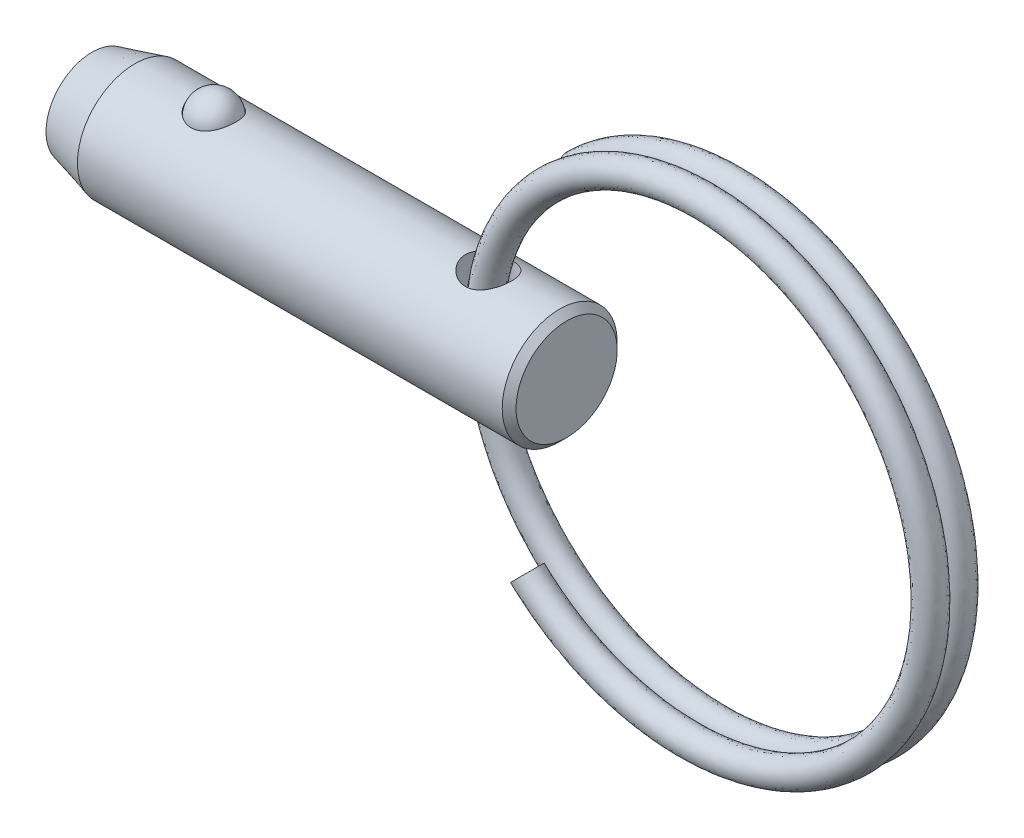
from build123d import *

# Parameters (mm, degrees)
SKETCH4_W          = 1.27
SKETCH4_H          = 6.35
SWEEP1_PITCH       = 1.5494
SWEEP1_HEIGHT      = 1.355725
SWEEP1_RADIUS      = 13.462
SKETCH6_R          = 0.762
SWEEP2_PITCH       = 1.5494
SWEEP2_HEIGHT      = 1.355725
SWEEP2_RADIUS      = 13.462
SWEEP2_START_ANGLE = -180
SKETCH6_2_R        = 0.762


with BuildPart() as part:
    # Sketch1 → Revolve1 (revolve)
    with BuildSketch(Plane.XY, mode=Mode.PRIVATE) as revolve1_sk:
        Polygon((5.588, 2.794), (5.207, 3.175), (-18.254947737, 3.175), (-20.6248, 2.54), (-20.6248, 0), (5.588, 0), align=None)
    revolve(revolve1_sk.sketch.rotate(Axis((5.588, 0, 0), (1, 0, 0)), 90), axis=Axis((5.588, 0, 0), (1, 0, 0)))

    # Sketch2 → Cut-Revolve1 (revolve, cut)
    with BuildSketch(Plane.XY):
        with BuildLine():
            Line((-12.632982051, 2.8575), (-15.147582051, 2.8575))
            ThreePointArc((-15.147582051, 2.8575), (-13.890282051, 4.1148), (-12.632982051, 2.8575))
        make_face()
    revolve(axis=Axis((-12.632982051, 2.8575, 0), (1, 0, 0)), mode=Mode.SUBTRACT)

    # Sketch4 → Cut-Revolve2 (revolve, cut)
    with BuildSketch(Plane.XY, mode=Mode.PRIVATE) as cut_revolve2_sk:
        with Locations((1.905, 0)):
            Rectangle(SKETCH4_W, SKETCH4_H)
    revolve(cut_revolve2_sk.sketch.rotate(Axis((1.27, -3.175, 0), (0, 1, 0)), 90), axis=Axis((1.27, -3.175, 0), (0, 1, 0)), mode=Mode.SUBTRACT)


with BuildPart() as body_2:
    # Sketch3 → Revolve2 (revolve)
    with BuildSketch(Plane.XY):
        with BuildLine():
            Line((-12.658382051, 2.8575), (-15.122182051, 2.8575))
            ThreePointArc((-15.122182051, 2.8575), (-13.890282051, 4.0894), (-12.658382051, 2.8575))
        make_face()
    revolve(axis=Axis((-12.658382051, 2.8575, 0), (1, 0, 0)))


with BuildPart() as body_3:
    # Sweep1: sweep along a helix
    with BuildLine() as sweep1_path:
        Helix(SWEEP1_PITCH, SWEEP1_HEIGHT, SWEEP1_RADIUS, center=(13.755025091, 0, 0), direction=(0, 0, -1), lefthand=True)
    # Sketch6 → Sweep1 (sweep)
    with BuildSketch(Plane(origin=(114.003847968, 0, 0), x_dir=(0, 0, -1), z_dir=(0, 1, 0))):
        with Locations((0, 112.948822877)):
            Circle(SKETCH6_R)
    sweep(path=sweep1_path.line, is_frenet=True)

    # Sweep2: sweep along a helix
    with BuildLine() as sweep2_path:
        add(Helix(SWEEP2_PITCH, SWEEP2_HEIGHT, SWEEP2_RADIUS, center=(13.755025091, 0, 0), direction=(0, 0, 1), lefthand=True, mode=Mode.PRIVATE).rotate(Axis((13.755025091, 0, 0), (0, 0, 1)), SWEEP2_START_ANGLE))
    # Sketch6<2> → Sweep2 (sweep)
    with BuildSketch(Plane(origin=(114.003847968, 0, 0), x_dir=(0, 0, -1), z_dir=(0, 1, 0))):
        with Locations((0, 112.948822877)):
            Circle(SKETCH6_2_R)
    sweep(path=sweep2_path.line, is_frenet=True)


solid = Compound([part.part, body_2.part, body_3.part])
